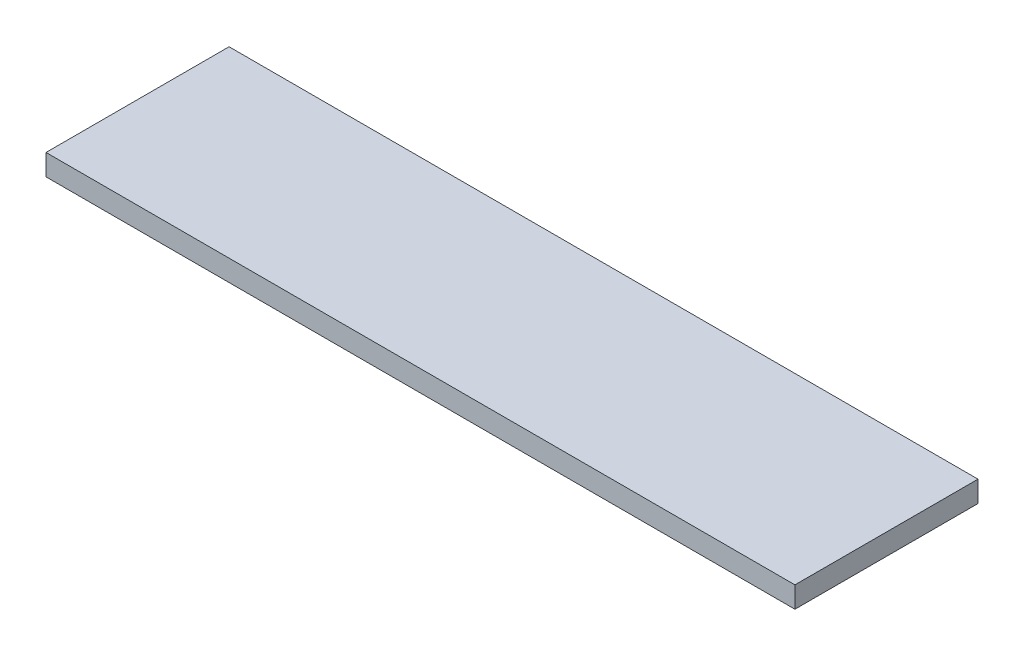
from build123d import *

# Parameters (mm, degrees)
SKETCH1_W           = 90
SKETCH1_H           = 22
BOSS_EXTRUDE1_DEPTH = 2.54


with BuildPart() as part:
    # Sketch1 → Boss-Extrude1 (new body)
    with BuildSketch(Plane(origin=(0, 0, 0), x_dir=(1, 0, 0), z_dir=(0, 1, 0))):
        Rectangle(SKETCH1_W, SKETCH1_H)
    extrude(amount=BOSS_EXTRUDE1_DEPTH)


solid = part.part
